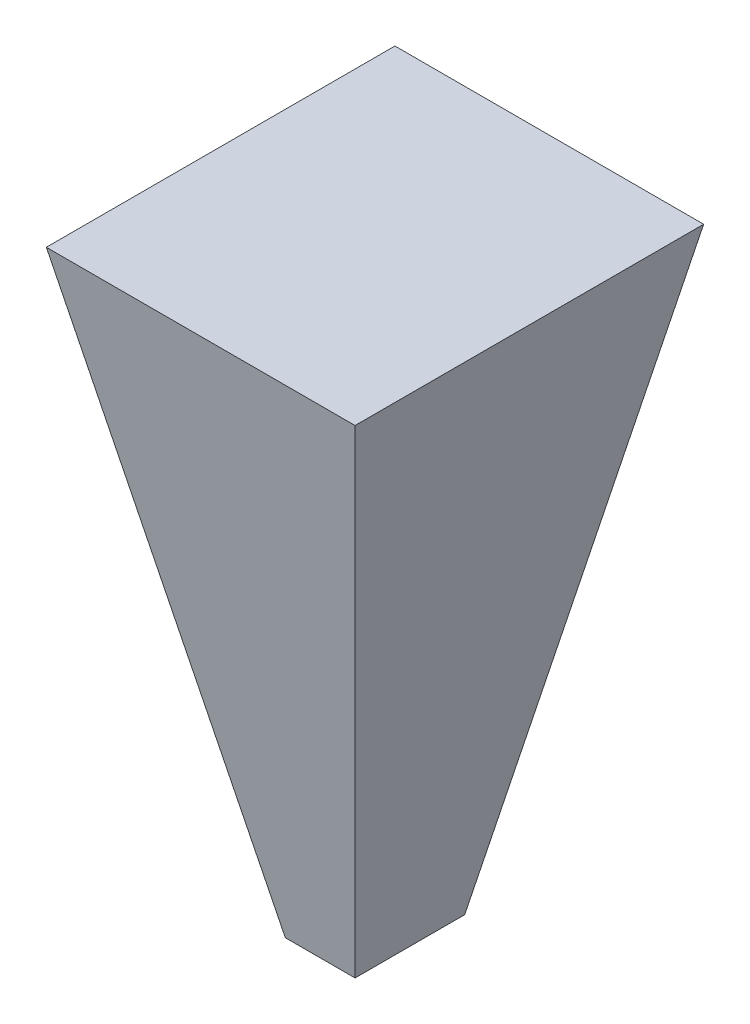
from build123d import *

# Parameters (mm, degrees)
SKETCH1_W           = 7
SKETCH1_H           = 11
BOSS_EXTRUDE1_DEPTH = 60
BOSS_EXTRUDE1_TAPER = -11.3


with BuildPart() as part:
    # Sketch1 → Boss-Extrude1 (new body)
    with BuildSketch(Plane(origin=(0, 0, 0), x_dir=(1, 0, 0), z_dir=(0, 1, 0))):
        Rectangle(SKETCH1_W, SKETCH1_H)
    extrude(amount=BOSS_EXTRUDE1_DEPTH, taper=BOSS_EXTRUDE1_TAPER)


solid = part.part
